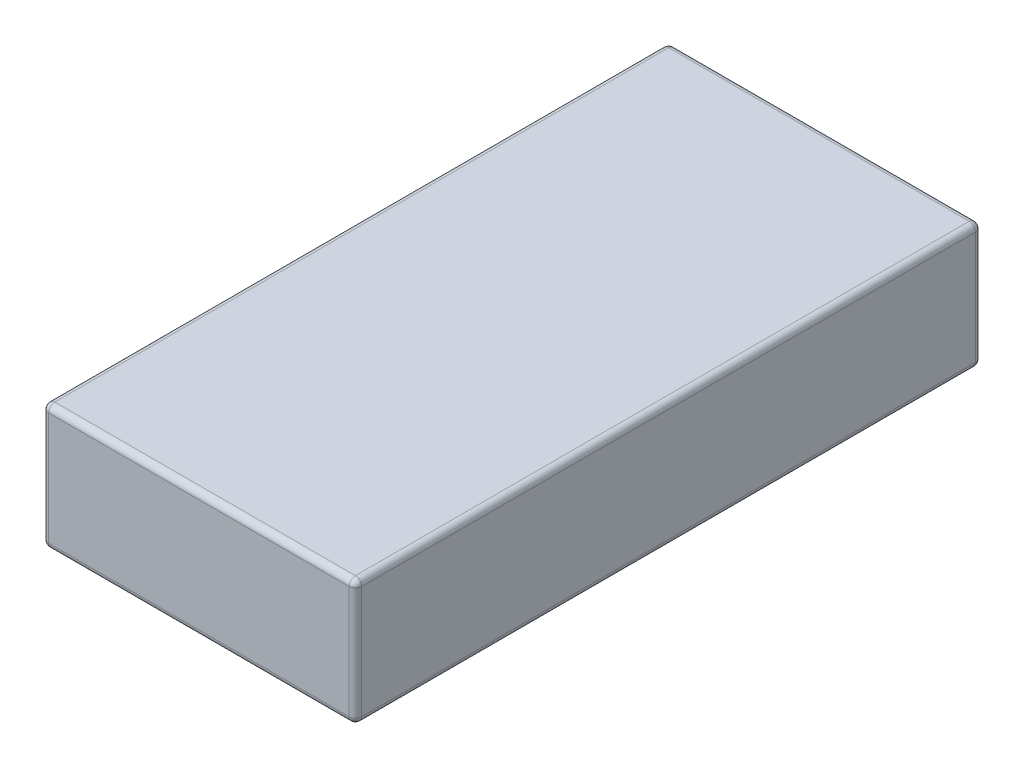
from build123d import *

# Parameters (mm, degrees)
SKETCH1_W           = 5
SKETCH1_H           = 10
BOSS_EXTRUDE1_DEPTH = 2
FILLET1_R           = 0.1


with BuildPart() as part:
    # Sketch1 → Boss-Extrude1 (new body)
    with BuildSketch(Plane(origin=(0, 0, 0), x_dir=(1, 0, 0), z_dir=(0, 1, 0))):
        Rectangle(SKETCH1_W, SKETCH1_H)
    extrude(amount=BOSS_EXTRUDE1_DEPTH)

    # Fillet1
    fillet1_edges = [part.edges().sort_by_distance(p)[0] for p in [
        (-2.5, 2, 0),
        (0, 2, 5),
        (2.5, 2, 0),
        (0, 0, 5),
        (-2.5, 0, 0),
        (0, 0, -5),
        (2.5, 0, 0),
        (2.5, 1, 5),
        (-2.5, 1, 5),
        (-2.5, 1, -5),
        (2.5, 1, -5),
        (0, 2, -5),
    ]]
    fillet(fillet1_edges, radius=FILLET1_R)


solid = part.part
